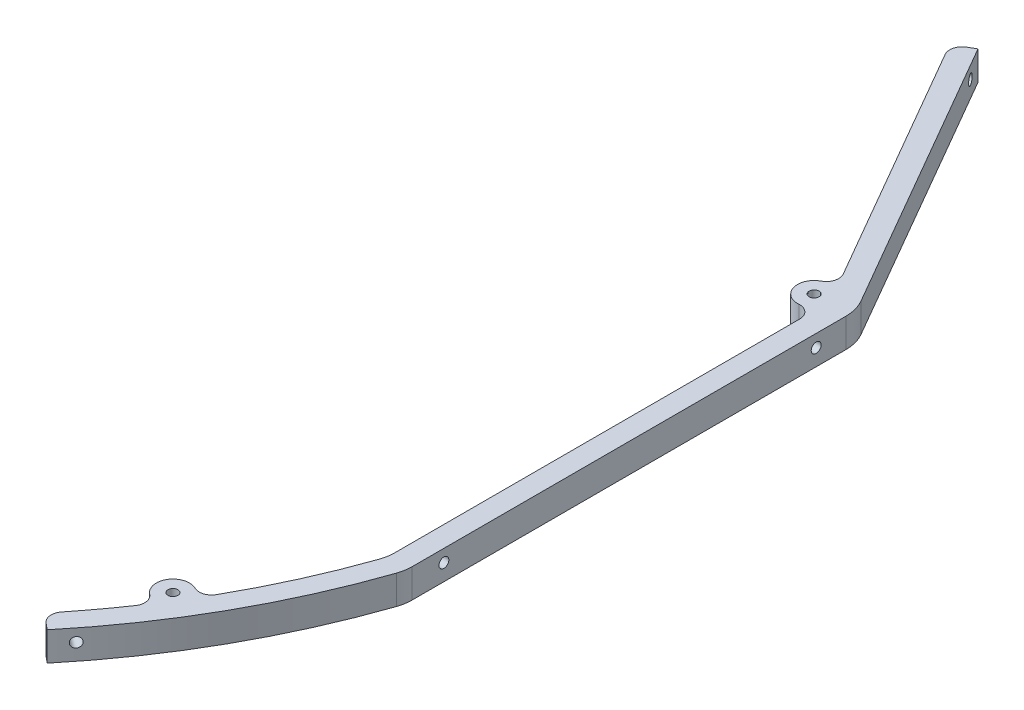
from build123d import *

# Parameters (mm, degrees)
BOSS_EXTRU_1_DEPTH                      = 7
ESQUISSE2_R                             = 4
ESQUISSE2_R_2                           = 1.2
BOSS_EXTRU_2_DEPTH                      = 7
CONG_1_R                                = 10
CONG_2_R                                = 3
DIAM_TRE_DU_PER_AGE_2_4_2_4_1_D         = 2.4
DIAM_TRE_DU_PER_AGE_2_4_2_4_1_ON_FACE_D = 2.4
DIAM_TRE_DU_PER_AGE_2_4_2_4_1_ON_F_2_D  = 2.4


with BuildPart() as part:
    # Esquisse1 → Boss.-Extru.1 (new body)
    with BuildSketch(Plane(origin=(0, 0, 0), x_dir=(1, 0, 0), z_dir=(0, 1, 0))):
        with BuildLine():
            Line((163.5, -54.314885969), (163.5, 54.839745962))
            Line((163.5, 54.839745962), (123.5, 124.121778265))
            Line((123.5, 124.121778265), (119.169872981, 121.621778265))
            Line((119.169872981, 121.621778265), (158.5, 53.5))
            Line((158.5, 53.5), (158.5, -53.5))
            ThreePointArc((158.5, -53.5), (146.077391865, -81.52236249), (128.750264504, -106.807627959))
            Line((128.750264504, -106.807627959), (132.598479772, -110))
            ThreePointArc((132.598479772, -110), (150.644566487, -83.59767596), (163.5, -54.314885969))
        make_face()
    extrude(amount=BOSS_EXTRU_1_DEPTH)

    # Esquisse2 → Boss.-Extru.2 (add)
    # profile 1 of 2: a face of its own
    with BuildSketch(Plane(origin=(0, 7, 0), x_dir=(1, 0, 0), z_dir=(0, 1, 0))):
        with Locations((155, 53)):
            Circle(ESQUISSE2_R)
        with Locations(Location((155, 53, 0), (0, 0, 270))):
            Circle(ESQUISSE2_R_2, mode=Mode.SUBTRACT)
    # profile 2 of 2: a face of its own
    with BuildSketch(Plane(origin=(0, 7, 0), x_dir=(1, 0, 0), z_dir=(0, 1, 0))):
        with Locations((140, -87)):
            Circle(ESQUISSE2_R)
        with Locations(Location((140, -87, 0), (0, 0, 270))):
            Circle(ESQUISSE2_R_2, mode=Mode.SUBTRACT)
    extrude(amount=-BOSS_EXTRU_2_DEPTH)

    # Congé1
    cong_1_edges = [part.edges().sort_by_distance(p)[0] for p in [
        (158.5, 3.5, 53.5),
        (163.5, 3.5, -54.839745962),
        (163.5, 3.5, 54.314885969),
    ]]
    fillet(cong_1_edges, radius=CONG_1_R)

    # Congé2
    cong_2_edges = [part.edges().sort_by_distance(p)[0] for p in [
        (128.750264504, 3.5, 106.807627959),
        (119.169872981, 3.5, -121.621778265),
        (156.697559724, 3.5, -56.621918136),
        (158.5, 3.5, -51.063508327),
        (140.380940937, 3.5, 90.981819183),
        (143.738827918, 3.5, 85.578322891),
    ]]
    fillet(cong_2_edges, radius=CONG_2_R)

    # Diamètre du perçage Ø2.4 (2.4)1 (through all)
    with Locations(Plane(origin=(135.734675085, 4, 106.105866084), x_dir=(-0.615871636874, 0, 0.787846512269), z_dir=(0.787846512269, 0, 0.615871636874))):
        with Locations((0, 0)):
            Hole(DIAM_TRE_DU_PER_AGE_2_4_2_4_1_D / 2)

    # Diamètre du perçage Ø2.4 (2.4)1 on face (through all)
    with Locations(Plane(origin=(163.5, 4, -45), x_dir=(0, 0, 1), z_dir=(1, 0, 0))):
        with Locations((0, 0), (90, 0)):
            Hole(DIAM_TRE_DU_PER_AGE_2_4_2_4_1_ON_FACE_D / 2)

    # Diamètre du perçage Ø2.4 (2.4)1 on f 2 (through all)
    with Locations(Plane(origin=(126, 4, -119.791651246), x_dir=(0.500000174844, 0, 0.866025302838), z_dir=(0.866025302838, 0, -0.500000174844))):
        with Locations((0, 0)):
            Hole(DIAM_TRE_DU_PER_AGE_2_4_2_4_1_ON_F_2_D / 2)


solid = part.part
